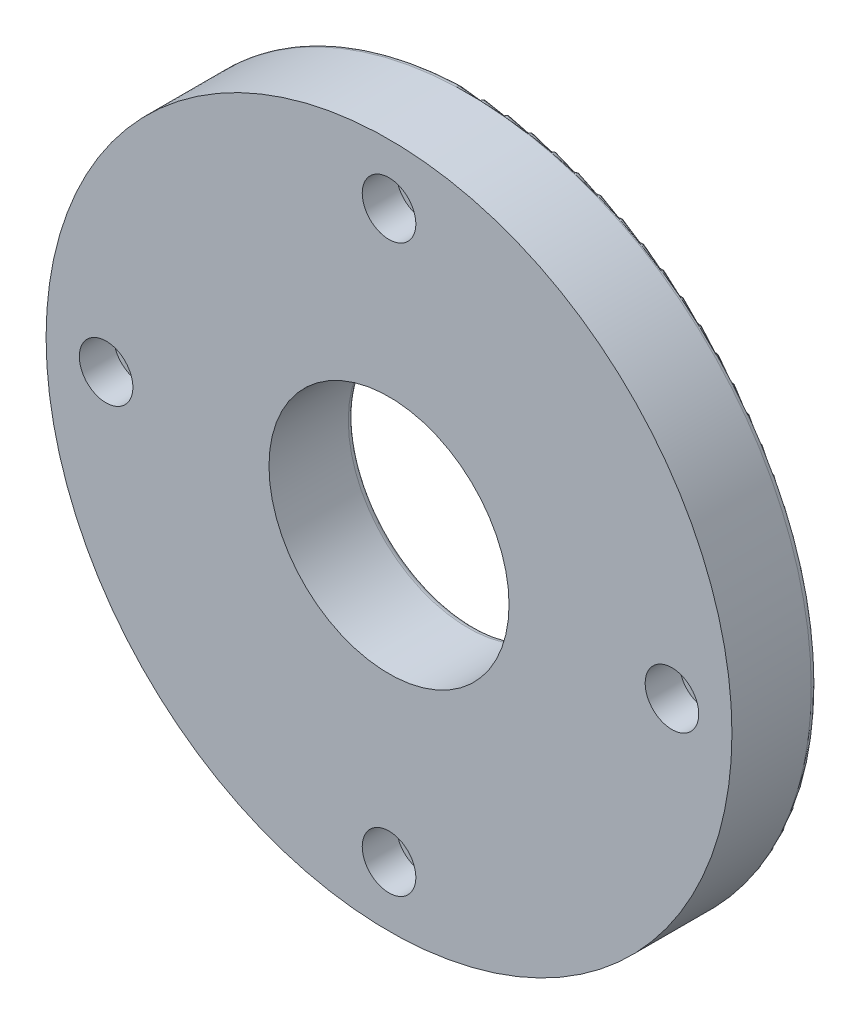
from build123d import *

# Parameters (mm, degrees)
SKETCH1_R           = 40
SKETCH1_R_2         = 14
BOSS_EXTRUDE1_DEPTH = 10
SKETCH2_R           = 1.7
CUT_EXTRUDE3_DEPTH  = 10
CUT_EXTRUDE4_START  = -10
SKETCH4_R           = 3.125
CUT_EXTRUDE4_DEPTH  = 4
FILLET1_R           = 0.75


with BuildPart() as part:
    # Sketch1 → Boss-Extrude1 (new body)
    with BuildSketch(Plane.XY):
        Circle(SKETCH1_R)
        Circle(SKETCH1_R_2, mode=Mode.SUBTRACT)
    extrude(amount=BOSS_EXTRUDE1_DEPTH)

    # Sketch2 → Cut-Extrude3 (cut)
    with BuildSketch(Plane(origin=(0, 0, 0), x_dir=(-1, 0, 0), z_dir=(0, 0, -1))):
        with Locations((0, 33)):
            Circle(SKETCH2_R)
        with Locations((33, 0)):
            Circle(SKETCH2_R)
        with Locations((0, -33)):
            Circle(SKETCH2_R)
        with Locations((-33, 0)):
            Circle(SKETCH2_R)
    extrude(amount=-CUT_EXTRUDE3_DEPTH, mode=Mode.SUBTRACT)

    # Sketch4 → Cut-Extrude4 (cut)
    with BuildSketch(Plane(origin=(0, 0, 0), x_dir=(-1, 0, 0), z_dir=(0, 0, -1)).offset(CUT_EXTRUDE4_START)):
        with Locations((0, 33)):
            Circle(SKETCH4_R)
        with Locations((33, 0)):
            Circle(SKETCH4_R)
        with Locations((0, -33)):
            Circle(SKETCH4_R)
        with Locations((-33, 0)):
            Circle(SKETCH4_R)
    extrude(amount=CUT_EXTRUDE4_DEPTH, mode=Mode.SUBTRACT)

    # Fillet1
    fillet1_edges = [part.edges().sort_by_distance(p)[0] for p in [
        (1.7, 33, 0),
        (-31.3, 0, 0),
        (1.7, -33, 0),
        (-40, 0, 0),
        (34.7, 0, 0),
        (-14, 0, 0),
    ]]
    fillet(fillet1_edges, radius=FILLET1_R)


solid = part.part
